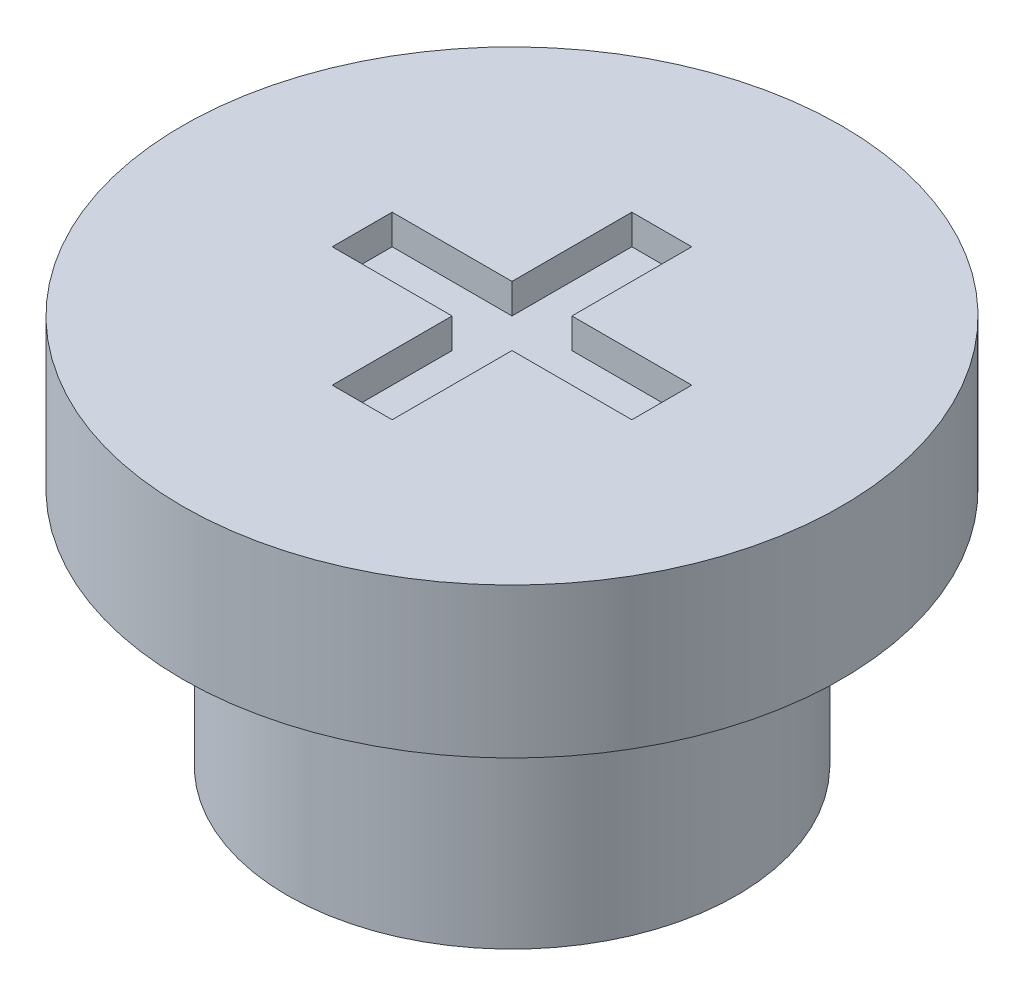
from build123d import *

# Parameters (mm, degrees)
SKETCH1_R           = 0.75
BOSS_EXTRUDE1_DEPTH = 0.8
SKETCH2_R           = 1.1
BOSS_EXTRUDE2_DEPTH = 0.5
CUT_EXTRUDE1_DEPTH  = 0.1


with BuildPart() as part:
    # Sketch1 → Boss-Extrude1 (new body)
    with BuildSketch(Plane(origin=(0, 0, 0), x_dir=(1, 0, 0), z_dir=(0, 1, 0))):
        with Locations(Location((0, 0, 0), (0, 0, 270))):
            Circle(SKETCH1_R)
    extrude(amount=BOSS_EXTRUDE1_DEPTH)

    # Sketch2 → Boss-Extrude2 (add)
    with BuildSketch(Plane(origin=(0, 0.8, 0), x_dir=(1, 0, 0), z_dir=(0, 1, 0))):
        with Locations(Location((0, 0, 0), (0, 0, 270))):
            Circle(SKETCH2_R)
    extrude(amount=BOSS_EXTRUDE2_DEPTH)

    # Sketch3 → Cut-Extrude1 (cut)
    with BuildSketch(Plane(origin=(0, 1.3, 0), x_dir=(1, 0, 0), z_dir=(0, 1, 0))):
        Polygon((-0.1, -0.1), (-0.1, -0.5), (0.1, -0.5), (0.1, -0.1), (0.5, -0.1), (0.5, 0.1), (0.1, 0.1), (0.1, 0.5), (-0.1, 0.5), (-0.1, 0.1), (-0.5, 0.1), (-0.5, -0.1), align=None)
    extrude(amount=-CUT_EXTRUDE1_DEPTH, mode=Mode.SUBTRACT)


solid = part.part
